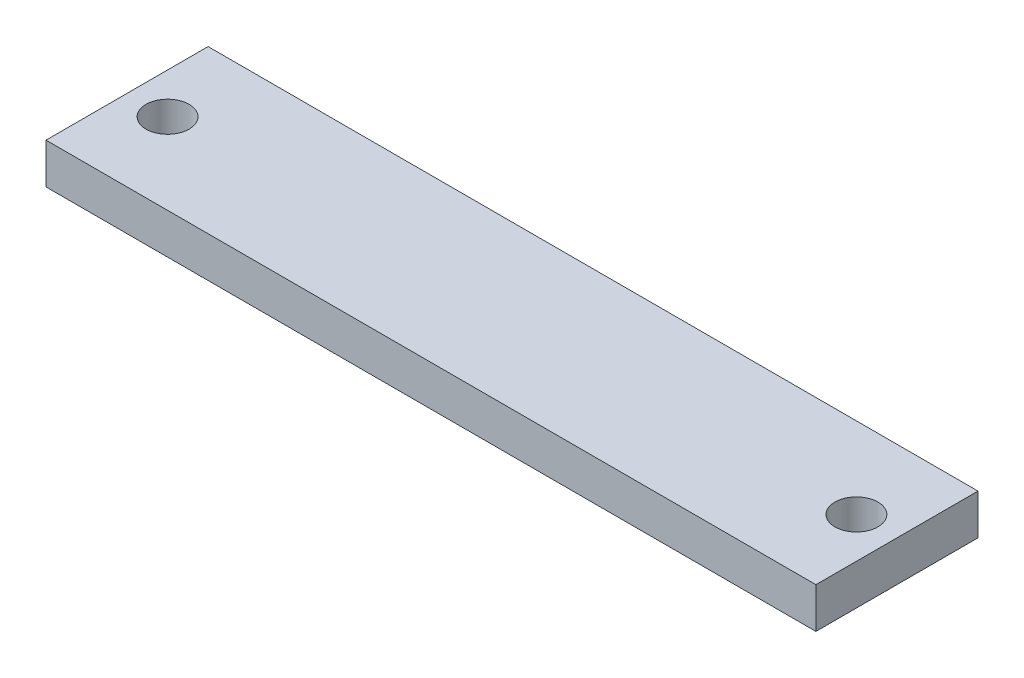
from build123d import *

# Parameters (mm, degrees)
SKETCH1_W               = 241.3
SKETCH1_H               = 50.8
BOSS_EXTRUDE1_DEPTH     = 12.7
F_1_2_CLEARANCE_HOLE1_D = 13.49248


with BuildPart() as part:
    # Sketch1 → Boss-Extrude1 (new body)
    with BuildSketch(Plane(origin=(0, 0, 0), x_dir=(1, 0, 0), z_dir=(0, 1, 0))):
        Rectangle(SKETCH1_W, SKETCH1_H)
    extrude(amount=BOSS_EXTRUDE1_DEPTH)

    # 1/2 Clearance Hole1 (through all)
    with Locations(Plane(origin=(0, 12.7, 0), x_dir=(1, 0, 0), z_dir=(0, 1, 0))):
        with Locations((-107.95, 0), (107.95, 0)):
            Hole(F_1_2_CLEARANCE_HOLE1_D / 2)


solid = part.part
